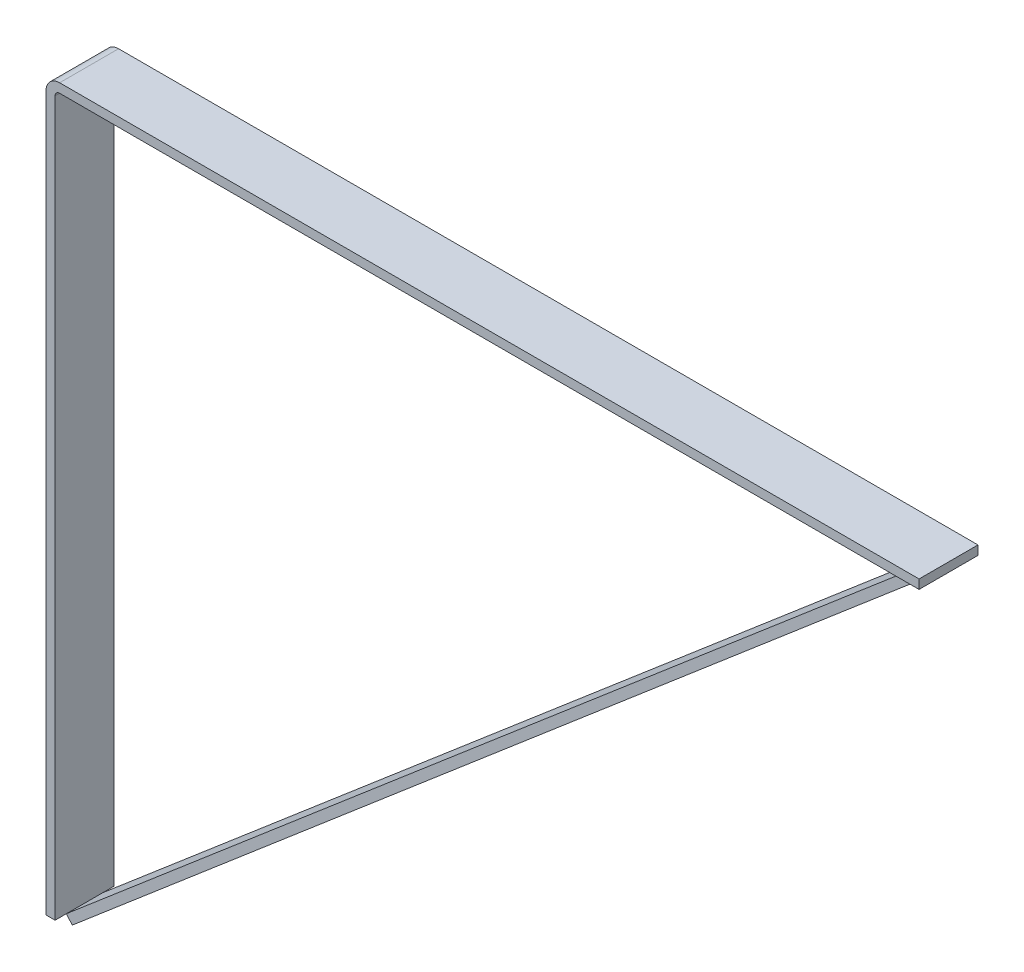
from build123d import *

# Parameters (mm, degrees)
EXTRUDE_THIN1_DEPTH = 20.574
BOSS_EXTRUDE1_DEPTH = 12.7


with BuildPart() as part:
    # Sketch1 → Extrude-Thin1 (new, symmetric)
    with BuildSketch(Plane.XY):
        with BuildLine():
            Line((-309.5625, -508), (-309.5625, -9.525))
            ThreePointArc((-309.5625, -9.525), (-306.772692091, -2.789807909), (-300.0375, 0))
            Line((-300.0375, 0), (300.0375, 0))
            Line((300.0375, 0), (300.0375, -6.35))
            Line((300.0375, -6.35), (-300.0375, -6.35))
            ThreePointArc((-300.0375, -6.35), (-302.28256403, -7.27993597), (-303.2125, -9.525))
            Line((-303.2125, -9.525), (-303.2125, -508))
            Line((-303.2125, -508), (-309.5625, -508))
        make_face()
    extrude(amount=EXTRUDE_THIN1_DEPTH, both=True)


with BuildPart() as body_2:
    # Sketch2 → Boss-Extrude1 (new, symmetric)
    with BuildSketch(Plane.XY):
        Polygon((285.250366412, -6.35), (-303.2125, -508), (-299.092992689, -512.832407217), (295.038551492, -6.35), align=None)
    extrude(amount=BOSS_EXTRUDE1_DEPTH, both=True)


solid = Compound([part.part, body_2.part])
